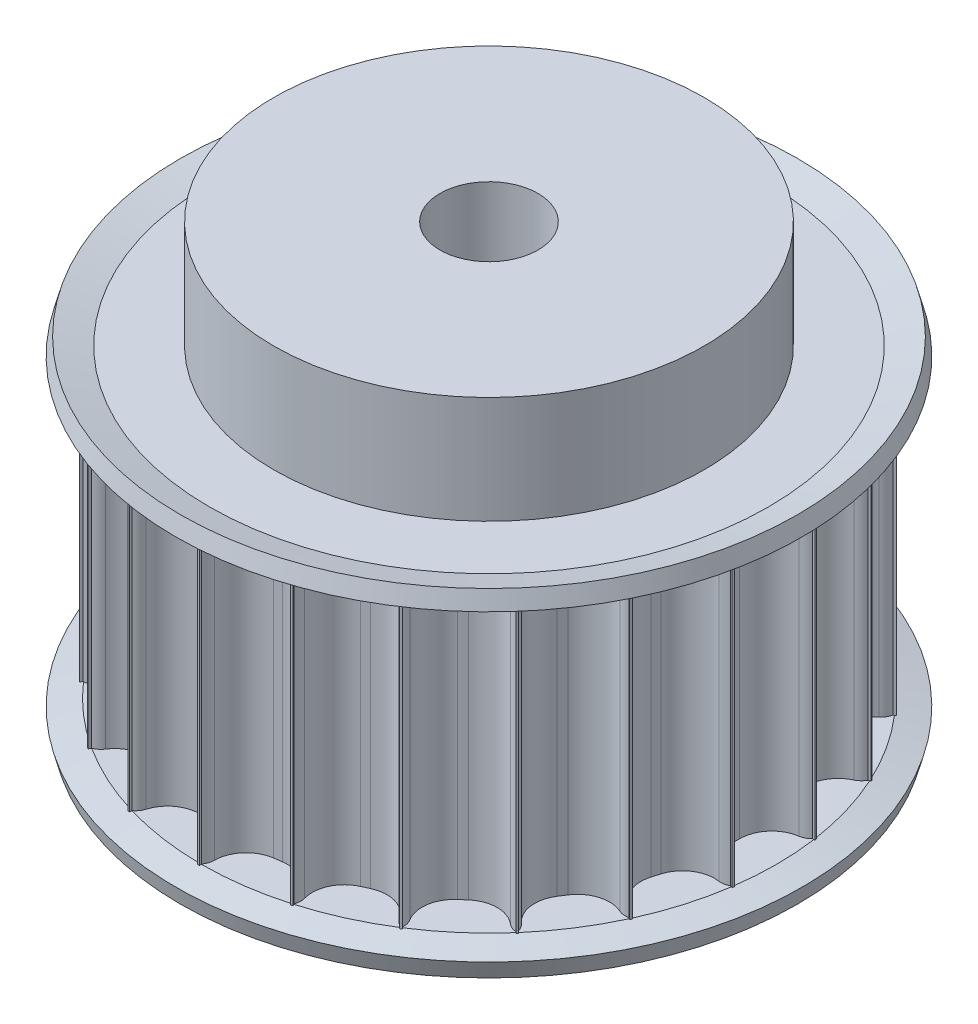
from build123d import *

# Parameters (mm, degrees)
SKETCH1_R           = 27
SKETCH1_R_2         = 6
BOSS_EXTRUDE1_DEPTH = 27
CUT_EXTRUDE1_DEPTH  = 27
CUT_EXTRUDE2_START  = -51
SKETCH4_R           = 4.574517491
CUT_EXTRUDE2_DEPTH  = 51


with BuildPart() as part:
    # Sketch1 → Boss-Extrude1 (new body)
    with BuildSketch(Plane(origin=(0, 0, 0), x_dir=(1, 0, 0), z_dir=(0, 1, 0))):
        with Locations(Location((0, 0, 0), (0, 0, 270))):
            Circle(SKETCH1_R)
        with Locations(Location((0, 0, 0), (0, 0, 270))):
            Circle(SKETCH1_R_2, mode=Mode.SUBTRACT)
    extrude(amount=BOSS_EXTRUDE1_DEPTH)

    # Sketch2 → Cut-Extrude1 (cut)
    with BuildSketch(Plane(origin=(0, 27, 0), x_dir=(1, 0, 0), z_dir=(0, 1, 0))):
        with BuildLine():
            Line((23.11107981, 0.36107981), (23.11107981, -0.36107981))
            ThreePointArc((23.11107981, -0.36107981), (23.83693382, -2.317673794), (25.663253155, -3.327466718))
            ThreePointArc((25.663253155, -3.327466718), (26.115480244, -3.471692608), (26.5, -3.75))
            Line((26.5, -3.75), (27.885854575, -3.75))
            Line((27.885854575, -3.75), (27.885854575, 3.75))
            Line((27.885854575, 3.75), (26.5, 3.75))
            ThreePointArc((26.5, 3.75), (26.115480244, 3.471692608), (25.663253155, 3.327466718))
            ThreePointArc((25.663253155, 3.327466718), (23.83693382, 2.317673794), (23.11107981, 0.36107981))
        make_face()
        with BuildLine():
            Line((22.276646628, -6.164690066), (22.073190752, -6.857597147))
            ThreePointArc((22.073190752, -6.857597147), (22.218406349, -8.939432033), (23.686255377, -10.422854864))
            ThreePointArc((23.686255377, -10.422854864), (24.079530962, -10.688645686), (24.370066713, -11.064011407))
            Line((24.370066713, -11.064011407), (25.69978444, -11.45445176))
            Line((25.69978444, -11.45445176), (27.812778616, -4.258254458))
            Line((27.812778616, -4.258254458), (26.483060889, -3.867814105))
            ThreePointArc((26.483060889, -3.867814105), (26.035708632, -4.026516359), (25.561166789, -4.037492993))
            ThreePointArc((25.561166789, -4.037492993), (23.524334677, -4.491848592), (22.276646628, -6.164690066))
        make_face()
        with BuildLine():
            Line((19.637492021, -12.191033415), (19.247063054, -12.798552746))
            ThreePointArc((19.247063054, -12.798552746), (18.799875734, -14.836970653), (19.790338055, -16.673845296))
            ThreePointArc((19.790338055, -16.673845296), (20.092801288, -17.039668259), (20.265815555, -17.481682411))
            Line((20.265815555, -17.481682411), (21.431670612, -18.230931961))
            Line((21.431670612, -18.230931961), (25.486476743, -11.921530465))
            Line((25.486476743, -11.921530465), (24.320621685, -11.172280914))
            ThreePointArc((24.320621685, -11.172280914), (23.846678746, -11.198520916), (23.388266707, -11.075359033))
            ThreePointArc((23.388266707, -11.075359033), (21.305933843, -10.937468119), (19.637492021, -12.191033415))
        make_face()
        with BuildLine():
            Line((15.407424599, -17.22973174), (14.861652774, -17.702645718))
            ThreePointArc((14.861652774, -17.702645718), (13.858290993, -19.53250615), (14.291125241, -21.574019946))
            ThreePointArc((14.291125241, -21.574019946), (14.47827235, -22.010238248), (14.519748546, -22.483091473))
            Line((14.519748546, -22.483091473), (15.42729029, -23.530450478))
            Line((15.42729029, -23.530450478), (21.095412097, -18.618994973))
            Line((21.095412097, -18.618994973), (20.187870353, -17.571635968))
            ThreePointArc((20.187870353, -17.571635968), (19.725732771, -17.46328791), (19.320588352, -17.215965352))
            ThreePointArc((19.320588352, -17.215965352), (17.36145296, -16.496999027), (15.407424599, -17.22973174))
        make_face()
        with BuildLine():
            Line((9.929139268, -20.872579668), (9.272239772, -21.172575616))
            ThreePointArc((9.272239772, -21.172575616), (7.793989935, -22.645634163), (7.634130453, -24.726395805))
            ThreePointArc((7.634130453, -24.726395805), (7.690799891, -25.197669634), (7.597377862, -25.663054176))
            Line((7.597377862, -25.663054176), (8.173082658, -26.923671838))
            Line((8.173082658, -26.923671838), (14.995322623, -23.80805924))
            Line((14.995322623, -23.80805924), (14.419617827, -22.547441578))
            ThreePointArc((14.419617827, -22.547441578), (14.006725239, -22.313283174), (13.687670833, -21.961836545))
            ThreePointArc((13.687670833, -21.961836545), (12.010450411, -20.720041185), (9.929139268, -20.872579668))
        make_face()
        with BuildLine():
            Line((3.646454124, -22.824455326), (2.931645047, -22.927229356))
            ThreePointArc((2.931645047, -22.927229356), (1.098266165, -23.924147575), (0.358663818, -25.875586129))
            ThreePointArc((0.358663818, -25.875586129), (0.280264565, -26.343735683), (0.059512807, -26.763948853))
            Line((0.059512807, -26.763948853), (0.256740477, -28.135697427))
            Line((0.256740477, -28.135697427), (7.680401291, -27.06833614))
            Line((7.680401291, -27.06833614), (7.483173621, -25.696587566))
            ThreePointArc((7.483173621, -25.696587566), (7.15297613, -25.355588939), (6.945859627, -24.928490354))
            ThreePointArc((6.945859627, -24.928490354), (5.686432598, -23.264468833), (3.646454124, -22.824455326))
        make_face()
        with BuildLine():
            Line((-2.931645047, -22.927229356), (-3.646454124, -22.824455326))
            ThreePointArc((-3.646454124, -22.824455326), (-5.686432598, -23.264468833), (-6.945859627, -24.928490354))
            ThreePointArc((-6.945859627, -24.928490354), (-7.15297613, -25.355588939), (-7.483173621, -25.696587566))
            Line((-7.483173621, -25.696587566), (-7.680401291, -27.06833614))
            Line((-7.680401291, -27.06833614), (-0.256740477, -28.135697427))
            Line((-0.256740477, -28.135697427), (-0.059512807, -26.763948853))
            ThreePointArc((-0.059512807, -26.763948853), (-0.280264565, -26.343735683), (-0.358663818, -25.875586129))
            ThreePointArc((-0.358663818, -25.875586129), (-1.098266165, -23.924147575), (-2.931645047, -22.927229356))
        make_face()
        with BuildLine():
            Line((-9.272239772, -21.172575616), (-9.929139268, -20.872579668))
            ThreePointArc((-9.929139268, -20.872579668), (-12.010450411, -20.720041185), (-13.687670833, -21.961836545))
            ThreePointArc((-13.687670833, -21.961836545), (-14.006725239, -22.313283174), (-14.419617827, -22.547441578))
            Line((-14.419617827, -22.547441578), (-14.995322623, -23.80805924))
            Line((-14.995322623, -23.80805924), (-8.173082658, -26.923671838))
            Line((-8.173082658, -26.923671838), (-7.597377862, -25.663054176))
            ThreePointArc((-7.597377862, -25.663054176), (-7.690799891, -25.197669634), (-7.634130453, -24.726395805))
            ThreePointArc((-7.634130453, -24.726395805), (-7.793989935, -22.645634163), (-9.272239772, -21.172575616))
        make_face()
        with BuildLine():
            Line((-14.861652774, -17.702645718), (-15.407424599, -17.22973174))
            ThreePointArc((-15.407424599, -17.22973174), (-17.36145296, -16.496999027), (-19.320588352, -17.215965352))
            ThreePointArc((-19.320588352, -17.215965352), (-19.725732771, -17.46328791), (-20.187870353, -17.571635968))
            Line((-20.187870353, -17.571635968), (-21.095412097, -18.618994973))
            Line((-21.095412097, -18.618994973), (-15.42729029, -23.530450478))
            Line((-15.42729029, -23.530450478), (-14.519748546, -22.483091473))
            ThreePointArc((-14.519748546, -22.483091473), (-14.47827235, -22.010238248), (-14.291125241, -21.574019946))
            ThreePointArc((-14.291125241, -21.574019946), (-13.858290993, -19.53250615), (-14.861652774, -17.702645718))
        make_face()
        with BuildLine():
            Line((-19.247063054, -12.798552746), (-19.637492021, -12.191033415))
            ThreePointArc((-19.637492021, -12.191033415), (-21.305933843, -10.937468119), (-23.388266707, -11.075359033))
            ThreePointArc((-23.388266707, -11.075359033), (-23.846678746, -11.198520916), (-24.320621685, -11.172280914))
            Line((-24.320621685, -11.172280914), (-25.486476743, -11.921530465))
            Line((-25.486476743, -11.921530465), (-21.431670612, -18.230931961))
            Line((-21.431670612, -18.230931961), (-20.265815555, -17.481682411))
            ThreePointArc((-20.265815555, -17.481682411), (-20.092801288, -17.039668259), (-19.790338055, -16.673845296))
            ThreePointArc((-19.790338055, -16.673845296), (-18.799875734, -14.836970653), (-19.247063054, -12.798552746))
        make_face()
        with BuildLine():
            Line((-22.073190752, -6.857597147), (-22.276646628, -6.164690066))
            ThreePointArc((-22.276646628, -6.164690066), (-23.524334677, -4.491848592), (-25.561166789, -4.037492993))
            ThreePointArc((-25.561166789, -4.037492993), (-26.035708632, -4.026516359), (-26.483060889, -3.867814105))
            Line((-26.483060889, -3.867814105), (-27.812778616, -4.258254458))
            Line((-27.812778616, -4.258254458), (-25.69978444, -11.45445176))
            Line((-25.69978444, -11.45445176), (-24.370066713, -11.064011407))
            ThreePointArc((-24.370066713, -11.064011407), (-24.079530962, -10.688645686), (-23.686255377, -10.422854864))
            ThreePointArc((-23.686255377, -10.422854864), (-22.218406349, -8.939432033), (-22.073190752, -6.857597147))
        make_face()
        with BuildLine():
            Line((-23.11107981, -0.36107981), (-23.11107981, 0.36107981))
            ThreePointArc((-23.11107981, 0.36107981), (-23.83693382, 2.317673794), (-25.663253155, 3.327466718))
            ThreePointArc((-25.663253155, 3.327466718), (-26.115480244, 3.471692608), (-26.5, 3.75))
            Line((-26.5, 3.75), (-27.885854575, 3.75))
            Line((-27.885854575, 3.75), (-27.885854575, -3.75))
            Line((-27.885854575, -3.75), (-26.5, -3.75))
            ThreePointArc((-26.5, -3.75), (-26.115480244, -3.471692608), (-25.663253155, -3.327466718))
            ThreePointArc((-25.663253155, -3.327466718), (-23.83693382, -2.317673794), (-23.11107981, -0.36107981))
        make_face()
        with BuildLine():
            Line((-22.276646628, 6.164690066), (-22.073190752, 6.857597147))
            ThreePointArc((-22.073190752, 6.857597147), (-22.218406349, 8.939432033), (-23.686255377, 10.422854864))
            ThreePointArc((-23.686255377, 10.422854864), (-24.079530962, 10.688645686), (-24.370066713, 11.064011407))
            Line((-24.370066713, 11.064011407), (-25.69978444, 11.45445176))
            Line((-25.69978444, 11.45445176), (-27.812778616, 4.258254458))
            Line((-27.812778616, 4.258254458), (-26.483060889, 3.867814105))
            ThreePointArc((-26.483060889, 3.867814105), (-26.035708632, 4.026516359), (-25.561166789, 4.037492993))
            ThreePointArc((-25.561166789, 4.037492993), (-23.524334677, 4.491848592), (-22.276646628, 6.164690066))
        make_face()
        with BuildLine():
            Line((-19.637492021, 12.191033415), (-19.247063054, 12.798552746))
            ThreePointArc((-19.247063054, 12.798552746), (-18.799875734, 14.836970653), (-19.790338055, 16.673845296))
            ThreePointArc((-19.790338055, 16.673845296), (-20.092801288, 17.039668259), (-20.265815555, 17.481682411))
            Line((-20.265815555, 17.481682411), (-21.431670612, 18.230931961))
            Line((-21.431670612, 18.230931961), (-25.486476743, 11.921530465))
            Line((-25.486476743, 11.921530465), (-24.320621685, 11.172280914))
            ThreePointArc((-24.320621685, 11.172280914), (-23.846678746, 11.198520916), (-23.388266707, 11.075359033))
            ThreePointArc((-23.388266707, 11.075359033), (-21.305933843, 10.937468119), (-19.637492021, 12.191033415))
        make_face()
        with BuildLine():
            Line((-15.407424599, 17.22973174), (-14.861652774, 17.702645718))
            ThreePointArc((-14.861652774, 17.702645718), (-13.858290993, 19.53250615), (-14.291125241, 21.574019946))
            ThreePointArc((-14.291125241, 21.574019946), (-14.47827235, 22.010238248), (-14.519748546, 22.483091473))
            Line((-14.519748546, 22.483091473), (-15.42729029, 23.530450478))
            Line((-15.42729029, 23.530450478), (-21.095412097, 18.618994973))
            Line((-21.095412097, 18.618994973), (-20.187870353, 17.571635968))
            ThreePointArc((-20.187870353, 17.571635968), (-19.725732771, 17.46328791), (-19.320588352, 17.215965352))
            ThreePointArc((-19.320588352, 17.215965352), (-17.36145296, 16.496999027), (-15.407424599, 17.22973174))
        make_face()
        with BuildLine():
            Line((-9.929139268, 20.872579668), (-9.272239772, 21.172575616))
            ThreePointArc((-9.272239772, 21.172575616), (-7.793989935, 22.645634163), (-7.634130453, 24.726395805))
            ThreePointArc((-7.634130453, 24.726395805), (-7.690799891, 25.197669634), (-7.597377862, 25.663054176))
            Line((-7.597377862, 25.663054176), (-8.173082658, 26.923671838))
            Line((-8.173082658, 26.923671838), (-14.995322623, 23.80805924))
            Line((-14.995322623, 23.80805924), (-14.419617827, 22.547441578))
            ThreePointArc((-14.419617827, 22.547441578), (-14.006725239, 22.313283174), (-13.687670833, 21.961836545))
            ThreePointArc((-13.687670833, 21.961836545), (-12.010450411, 20.720041185), (-9.929139268, 20.872579668))
        make_face()
        with BuildLine():
            Line((-3.646454124, 22.824455326), (-2.931645047, 22.927229356))
            ThreePointArc((-2.931645047, 22.927229356), (-1.098266165, 23.924147575), (-0.358663818, 25.875586129))
            ThreePointArc((-0.358663818, 25.875586129), (-0.280264565, 26.343735683), (-0.059512807, 26.763948853))
            Line((-0.059512807, 26.763948853), (-0.256740477, 28.135697427))
            Line((-0.256740477, 28.135697427), (-7.680401291, 27.06833614))
            Line((-7.680401291, 27.06833614), (-7.483173621, 25.696587566))
            ThreePointArc((-7.483173621, 25.696587566), (-7.15297613, 25.355588939), (-6.945859627, 24.928490354))
            ThreePointArc((-6.945859627, 24.928490354), (-5.686432598, 23.264468833), (-3.646454124, 22.824455326))
        make_face()
        with BuildLine():
            Line((2.931645047, 22.927229356), (3.646454124, 22.824455326))
            ThreePointArc((3.646454124, 22.824455326), (5.686432598, 23.264468833), (6.945859627, 24.928490354))
            ThreePointArc((6.945859627, 24.928490354), (7.15297613, 25.355588939), (7.483173621, 25.696587566))
            Line((7.483173621, 25.696587566), (7.680401291, 27.06833614))
            Line((7.680401291, 27.06833614), (0.256740477, 28.135697427))
            Line((0.256740477, 28.135697427), (0.059512807, 26.763948853))
            ThreePointArc((0.059512807, 26.763948853), (0.280264565, 26.343735683), (0.358663818, 25.875586129))
            ThreePointArc((0.358663818, 25.875586129), (1.098266165, 23.924147575), (2.931645047, 22.927229356))
        make_face()
        with BuildLine():
            Line((9.272239772, 21.172575616), (9.929139268, 20.872579668))
            ThreePointArc((9.929139268, 20.872579668), (12.010450411, 20.720041185), (13.687670833, 21.961836545))
            ThreePointArc((13.687670833, 21.961836545), (14.006725239, 22.313283174), (14.419617827, 22.547441578))
            Line((14.419617827, 22.547441578), (14.995322623, 23.80805924))
            Line((14.995322623, 23.80805924), (8.173082658, 26.923671838))
            Line((8.173082658, 26.923671838), (7.597377862, 25.663054176))
            ThreePointArc((7.597377862, 25.663054176), (7.690799891, 25.197669634), (7.634130453, 24.726395805))
            ThreePointArc((7.634130453, 24.726395805), (7.793989935, 22.645634163), (9.272239772, 21.172575616))
        make_face()
        with BuildLine():
            Line((14.861652774, 17.702645718), (15.407424599, 17.22973174))
            ThreePointArc((15.407424599, 17.22973174), (17.36145296, 16.496999027), (19.320588352, 17.215965352))
            ThreePointArc((19.320588352, 17.215965352), (19.725732771, 17.46328791), (20.187870353, 17.571635968))
            Line((20.187870353, 17.571635968), (21.095412097, 18.618994973))
            Line((21.095412097, 18.618994973), (15.42729029, 23.530450478))
            Line((15.42729029, 23.530450478), (14.519748546, 22.483091473))
            ThreePointArc((14.519748546, 22.483091473), (14.47827235, 22.010238248), (14.291125241, 21.574019946))
            ThreePointArc((14.291125241, 21.574019946), (13.858290993, 19.53250615), (14.861652774, 17.702645718))
        make_face()
        with BuildLine():
            Line((19.247063054, 12.798552746), (19.637492021, 12.191033415))
            ThreePointArc((19.637492021, 12.191033415), (21.305933843, 10.937468119), (23.388266707, 11.075359033))
            ThreePointArc((23.388266707, 11.075359033), (23.846678746, 11.198520916), (24.320621685, 11.172280914))
            Line((24.320621685, 11.172280914), (25.486476743, 11.921530465))
            Line((25.486476743, 11.921530465), (21.431670612, 18.230931961))
            Line((21.431670612, 18.230931961), (20.265815555, 17.481682411))
            ThreePointArc((20.265815555, 17.481682411), (20.092801288, 17.039668259), (19.790338055, 16.673845296))
            ThreePointArc((19.790338055, 16.673845296), (18.799875734, 14.836970653), (19.247063054, 12.798552746))
        make_face()
        with BuildLine():
            Line((22.073190752, 6.857597147), (22.276646628, 6.164690066))
            ThreePointArc((22.276646628, 6.164690066), (23.524334677, 4.491848592), (25.561166789, 4.037492993))
            ThreePointArc((25.561166789, 4.037492993), (26.035708632, 4.026516359), (26.483060889, 3.867814105))
            Line((26.483060889, 3.867814105), (27.812778616, 4.258254458))
            Line((27.812778616, 4.258254458), (25.69978444, 11.45445176))
            Line((25.69978444, 11.45445176), (24.370066713, 11.064011407))
            ThreePointArc((24.370066713, 11.064011407), (24.079530962, 10.688645686), (23.686255377, 10.422854864))
            ThreePointArc((23.686255377, 10.422854864), (22.218406349, 8.939432033), (22.073190752, 6.857597147))
        make_face()
    extrude(amount=-CUT_EXTRUDE1_DEPTH, mode=Mode.SUBTRACT)

    # Sketch3 → Revolve1 (revolve)
    with BuildSketch(Plane.XY, mode=Mode.PRIVATE) as revolve1_sk:
        Polygon((-25.971088894, -1.5), (-19.981088894, -1.5), (0.093428597, -1.5), (0.093428597, 0), (-4.481088894, 0), (-26.711722654, 0), (-29.107218703, -0.641871232), (-28.682605648, -2.226548725), align=None)
        Polygon((-26.711722654, 27), (-29.107218703, 27.641871232), (-28.682605648, 29.226548725), (-25.971088894, 28.5), (-19.981088894, 28.5), (-19.981088894, 38.5), (-4.481088894, 38.5), (-4.481088894, 27), align=None)
    revolve(revolve1_sk.sketch.rotate(Axis((0.093428597, 0, 0), (0, 1, 0)), 270), axis=Axis((0.093428597, 0, 0), (0, 1, 0)))

    # Sketch4 → Cut-Extrude2 (cut)
    with BuildSketch(Plane(origin=(0, 38.5, 0), x_dir=(1, 0, 0), z_dir=(0, 1, 0)).offset(CUT_EXTRUDE2_START)):
        with Locations(Location((0.093428597, 0, 0), (0, 0, 90))):
            Circle(SKETCH4_R)
    extrude(amount=CUT_EXTRUDE2_DEPTH, mode=Mode.SUBTRACT)


solid = part.part
